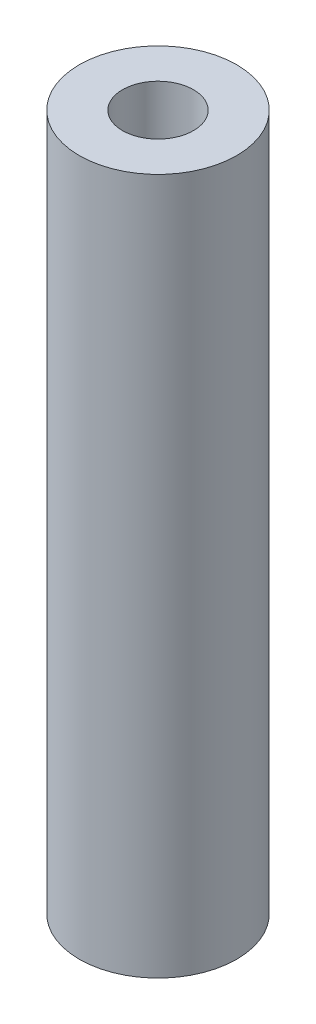
from build123d import *

# Parameters (mm, degrees)
SKETCH1_R                 = 3
BOSS_EXTRUDE1_DEPTH       = 26.53
F_6_32_TAPPED_HOLE1_D     = 2.7051
F_6_32_TAPPED_HOLE1_DEPTH = 10
F_6_32_TAPPED_HOLE1_TIP   = 0.81269403
F_6_32_TAPPED_HOLE2_D     = 2.7051
F_6_32_TAPPED_HOLE2_DEPTH = 10
F_6_32_TAPPED_HOLE2_TIP   = 0.81269403


with BuildPart() as part:
    # Sketch1 → Boss-Extrude1 (new body)
    with BuildSketch(Plane(origin=(0, 0, 0), x_dir=(1, 0, 0), z_dir=(0, 1, 0))):
        with Locations(Location((0, 0, 0), (0, 0, 270))):
            Circle(SKETCH1_R)
    extrude(amount=BOSS_EXTRUDE1_DEPTH)

    # #6-32 Tapped Hole1
    with Locations(Plane(origin=(0, 26.53, 0), x_dir=(1, 0, 0), z_dir=(0, 1, 0))):
        with Locations((0, 0)):
            Hole(F_6_32_TAPPED_HOLE1_D / 2, depth=F_6_32_TAPPED_HOLE1_DEPTH)
            with Locations((0, 0, -(F_6_32_TAPPED_HOLE1_DEPTH + F_6_32_TAPPED_HOLE1_TIP / 2))):  # 118° drill point
                Cone(0, F_6_32_TAPPED_HOLE1_D / 2, F_6_32_TAPPED_HOLE1_TIP, mode=Mode.SUBTRACT)

    # #6-32 Tapped Hole2
    with Locations(Plane(origin=(0, 0, 0), x_dir=(-1, 0, 0), z_dir=(0, -1, 0))):
        with Locations((0, 0)):
            Hole(F_6_32_TAPPED_HOLE2_D / 2, depth=F_6_32_TAPPED_HOLE2_DEPTH)
            with Locations((0, 0, -(F_6_32_TAPPED_HOLE2_DEPTH + F_6_32_TAPPED_HOLE2_TIP / 2))):  # 118° drill point
                Cone(0, F_6_32_TAPPED_HOLE2_D / 2, F_6_32_TAPPED_HOLE2_TIP, mode=Mode.SUBTRACT)


solid = part.part
